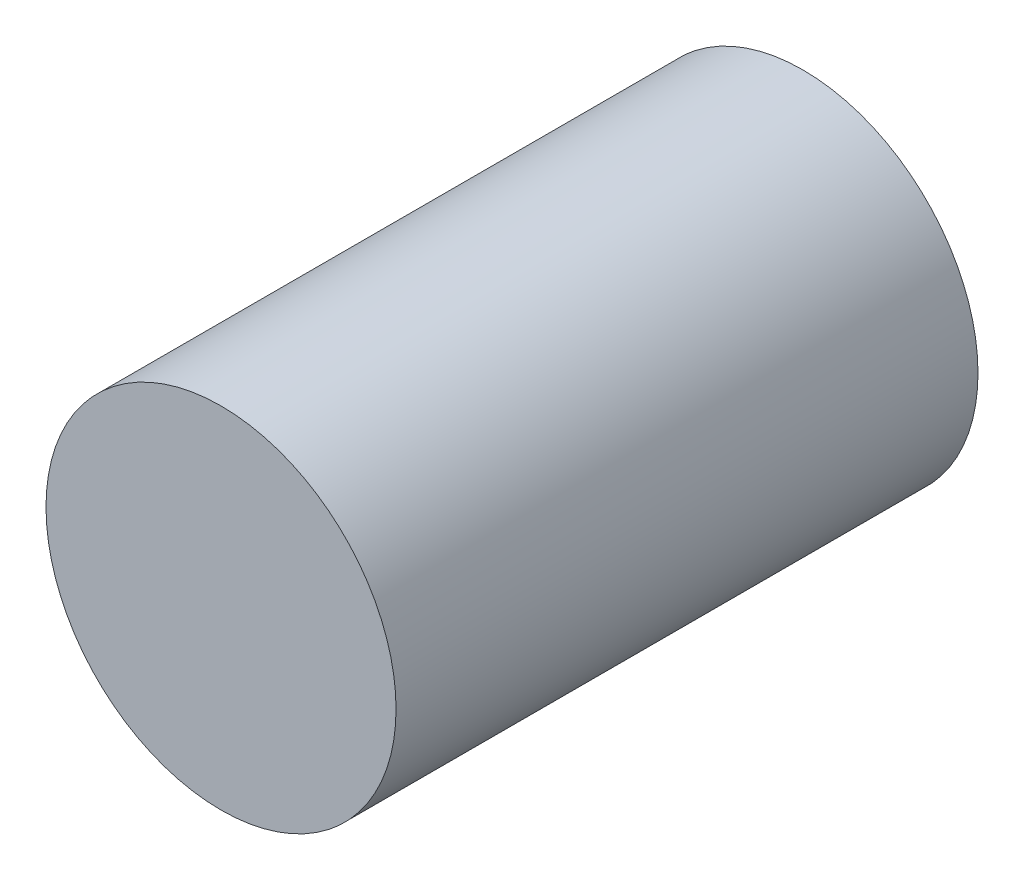
from build123d import *

# Parameters (mm, degrees)
SKETCH1_R           = 6.015
BOSS_EXTRUDE3_DEPTH = 10


with BuildPart() as part:
    # Sketch1 → Boss-Extrude3 (new, symmetric)
    with BuildSketch(Plane.XY):
        Circle(SKETCH1_R)
    extrude(amount=BOSS_EXTRUDE3_DEPTH, both=True)


solid = part.part
